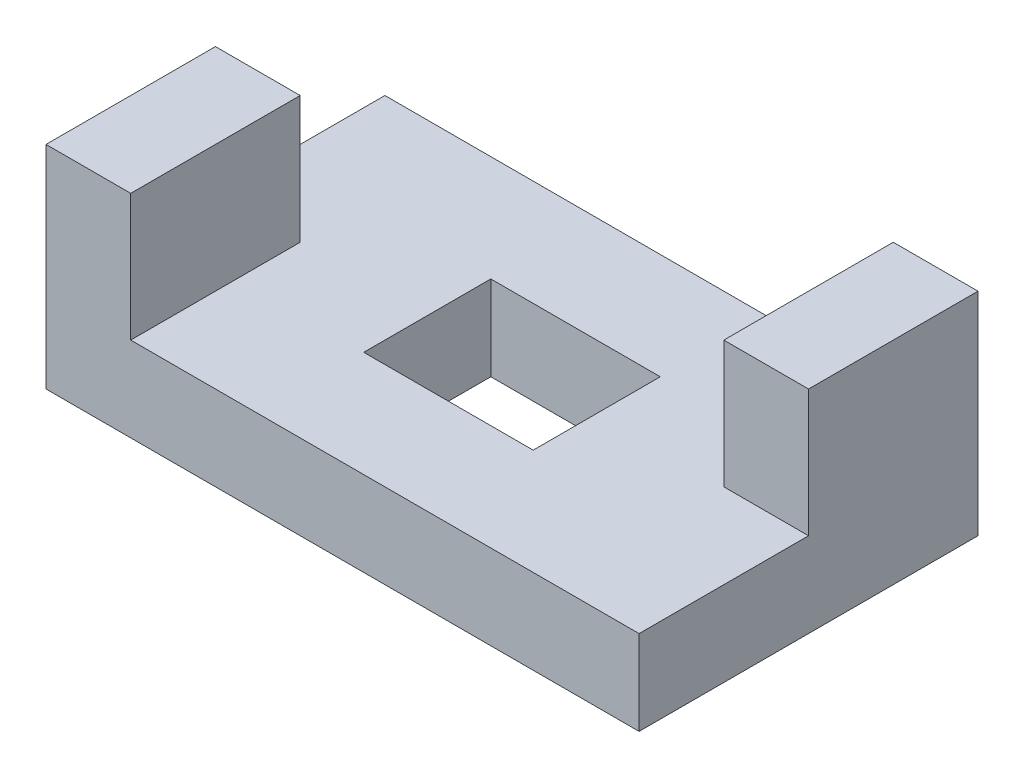
from build123d import *

# Parameters (mm, degrees)
SKETCH1_W           = 112
SKETCH1_H           = 64
BOSS_EXTRUDE1_DEPTH = 16
SKETCH3_W           = 16
SKETCH3_H           = 40
BOSS_EXTRUDE2_DEPTH = 32
SKETCH6_W           = 16
SKETCH6_H           = 40
BOSS_EXTRUDE3_DEPTH = 32
CUT_EXTRUDE1_REACH  = 133.21
SKETCH7_W           = 32
SKETCH7_H           = 24


with BuildPart() as part:
    # Sketch1 → Boss-Extrude1 (new body)
    with BuildSketch(Plane(origin=(0, 0, 0), x_dir=(1, 0, 0), z_dir=(0, 1, 0))):
        with Locations((56, 32)):
            Rectangle(SKETCH1_W, SKETCH1_H)
    extrude(amount=BOSS_EXTRUDE1_DEPTH)

    # Sketch3 → Boss-Extrude2 (add)
    with BuildSketch(Plane.XY):
        with Locations((8, 20)):
            Rectangle(SKETCH3_W, SKETCH3_H)
    extrude(amount=-BOSS_EXTRUDE2_DEPTH)

    # Sketch6 → Boss-Extrude3 (add)
    with BuildSketch(Plane(origin=(0, 0, -64), x_dir=(-1, 0, 0), z_dir=(0, 0, -1))):
        with Locations((-104, 20)):
            Rectangle(SKETCH6_W, SKETCH6_H)
    extrude(amount=-BOSS_EXTRUDE3_DEPTH)

    # Sketch7 → Cut-Extrude1 (cut, up to next)
    with BuildSketch(Plane(origin=(0, 16, 0), x_dir=(1, 0, 0), z_dir=(0, 1, 0)), mode=Mode.PRIVATE) as cut_extrude1_sk1:
        with Locations((56, 32)):
            Rectangle(SKETCH7_W, SKETCH7_H)
    cut_extrude1_tool1 = extrude(cut_extrude1_sk1.sketch, amount=-CUT_EXTRUDE1_REACH, mode=Mode.PRIVATE) & part.part
    add(cut_extrude1_tool1.solids().sort_by_distance((56, 16, -32))[0], mode=Mode.SUBTRACT)


solid = part.part
